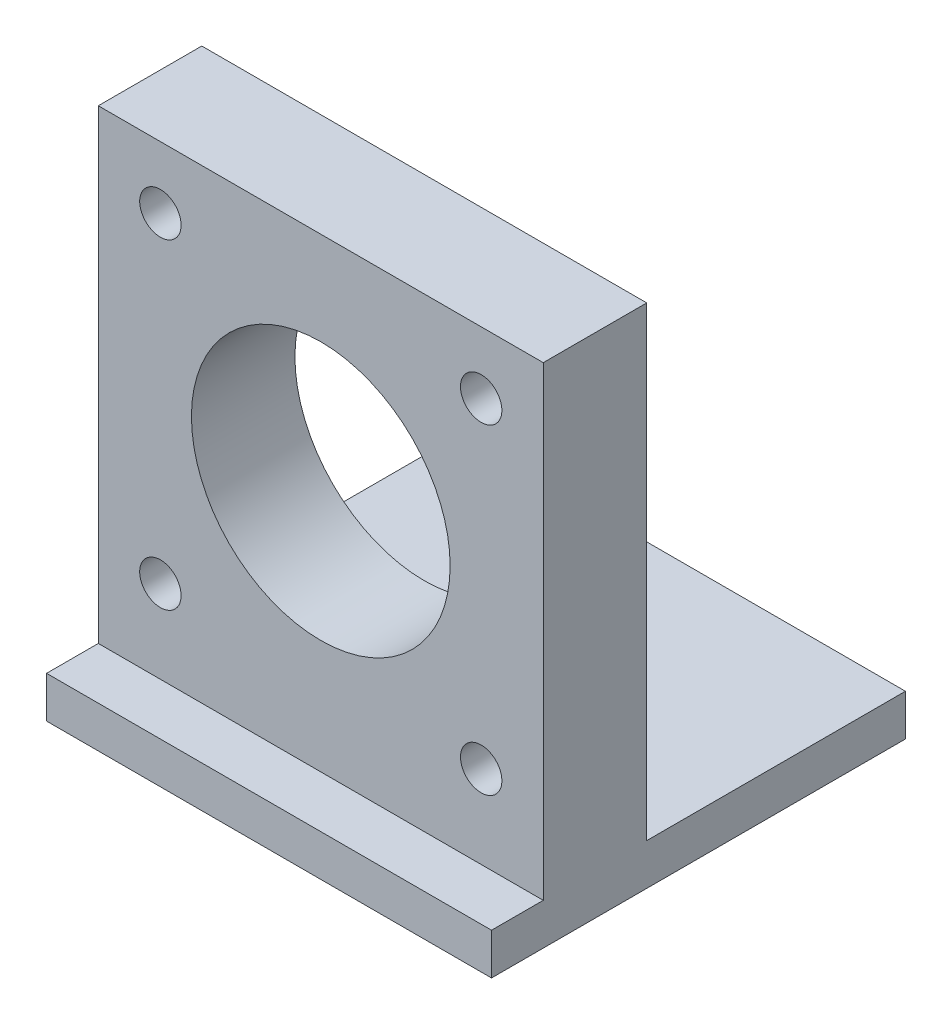
from build123d import *

# Parameters (mm, degrees)
SKETCH1_W           = 43
SKETCH1_H           = 40
BOSS_EXTRUDE1_DEPTH = 4
SKETCH2_W           = 43
SKETCH2_H           = 10
BOSS_EXTRUDE2_DEPTH = 45
CUT_EXTRUDE1_REACH  = 68.03
SKETCH3_R           = 12.5
SKETCH3_R_2         = 2


with BuildPart() as part:
    # Sketch1 → Boss-Extrude1 (new body)
    with BuildSketch(Plane(origin=(0, 0, 0), x_dir=(1, 0, 0), z_dir=(0, 1, 0))):
        with Locations((-5.590648476, 5.669439574)):
            Rectangle(SKETCH1_W, SKETCH1_H)
    extrude(amount=BOSS_EXTRUDE1_DEPTH)

    # Sketch2 → Boss-Extrude2 (add)
    with BuildSketch(Plane(origin=(0, 4, 0), x_dir=(1, 0, 0), z_dir=(0, 1, 0))):
        with Locations((-5.590648476, -4.330560426)):
            Rectangle(SKETCH2_W, SKETCH2_H)
    extrude(amount=BOSS_EXTRUDE2_DEPTH)

    # Sketch3 → Cut-Extrude1 (cut, up to next)
    with BuildSketch(Plane.XY.offset(9.330560426), mode=Mode.PRIVATE) as cut_extrude1_sk1:
        with Locations((-5.590648476, 27.5)):
            Circle(SKETCH3_R)
    cut_extrude1_tool1 = extrude(cut_extrude1_sk1.sketch, amount=-CUT_EXTRUDE1_REACH, mode=Mode.PRIVATE) & part.part
    # Sketch3 → Cut-Extrude1 (cut, up to next)
    with BuildSketch(Plane.XY.offset(9.330560426), mode=Mode.PRIVATE) as cut_extrude1_sk2:
        with Locations((-21.090648476, 43)):
            Circle(SKETCH3_R_2)
    cut_extrude1_tool2 = extrude(cut_extrude1_sk2.sketch, amount=-CUT_EXTRUDE1_REACH, mode=Mode.PRIVATE) & part.part
    # Sketch3 → Cut-Extrude1 (cut, up to next)
    with BuildSketch(Plane.XY.offset(9.330560426), mode=Mode.PRIVATE) as cut_extrude1_sk3:
        with Locations((9.909351524, 43)):
            Circle(SKETCH3_R_2)
    cut_extrude1_tool3 = extrude(cut_extrude1_sk3.sketch, amount=-CUT_EXTRUDE1_REACH, mode=Mode.PRIVATE) & part.part
    # Sketch3 → Cut-Extrude1 (cut, up to next)
    with BuildSketch(Plane.XY.offset(9.330560426), mode=Mode.PRIVATE) as cut_extrude1_sk4:
        with Locations((9.909351524, 12)):
            Circle(SKETCH3_R_2)
    cut_extrude1_tool4 = extrude(cut_extrude1_sk4.sketch, amount=-CUT_EXTRUDE1_REACH, mode=Mode.PRIVATE) & part.part
    # Sketch3 → Cut-Extrude1 (cut, up to next)
    with BuildSketch(Plane.XY.offset(9.330560426), mode=Mode.PRIVATE) as cut_extrude1_sk5:
        with Locations((-21.090648476, 12)):
            Circle(SKETCH3_R_2)
    cut_extrude1_tool5 = extrude(cut_extrude1_sk5.sketch, amount=-CUT_EXTRUDE1_REACH, mode=Mode.PRIVATE) & part.part
    add(cut_extrude1_tool1.solids().sort_by_distance((-5.590648, 27.5, 9.33056))[0], mode=Mode.SUBTRACT)
    add(cut_extrude1_tool2.solids().sort_by_distance((-21.090648, 43, 9.33056))[0], mode=Mode.SUBTRACT)
    add(cut_extrude1_tool3.solids().sort_by_distance((9.909352, 43, 9.33056))[0], mode=Mode.SUBTRACT)
    add(cut_extrude1_tool4.solids().sort_by_distance((9.909352, 12, 9.33056))[0], mode=Mode.SUBTRACT)
    add(cut_extrude1_tool5.solids().sort_by_distance((-21.090648, 12, 9.33056))[0], mode=Mode.SUBTRACT)


solid = part.part
